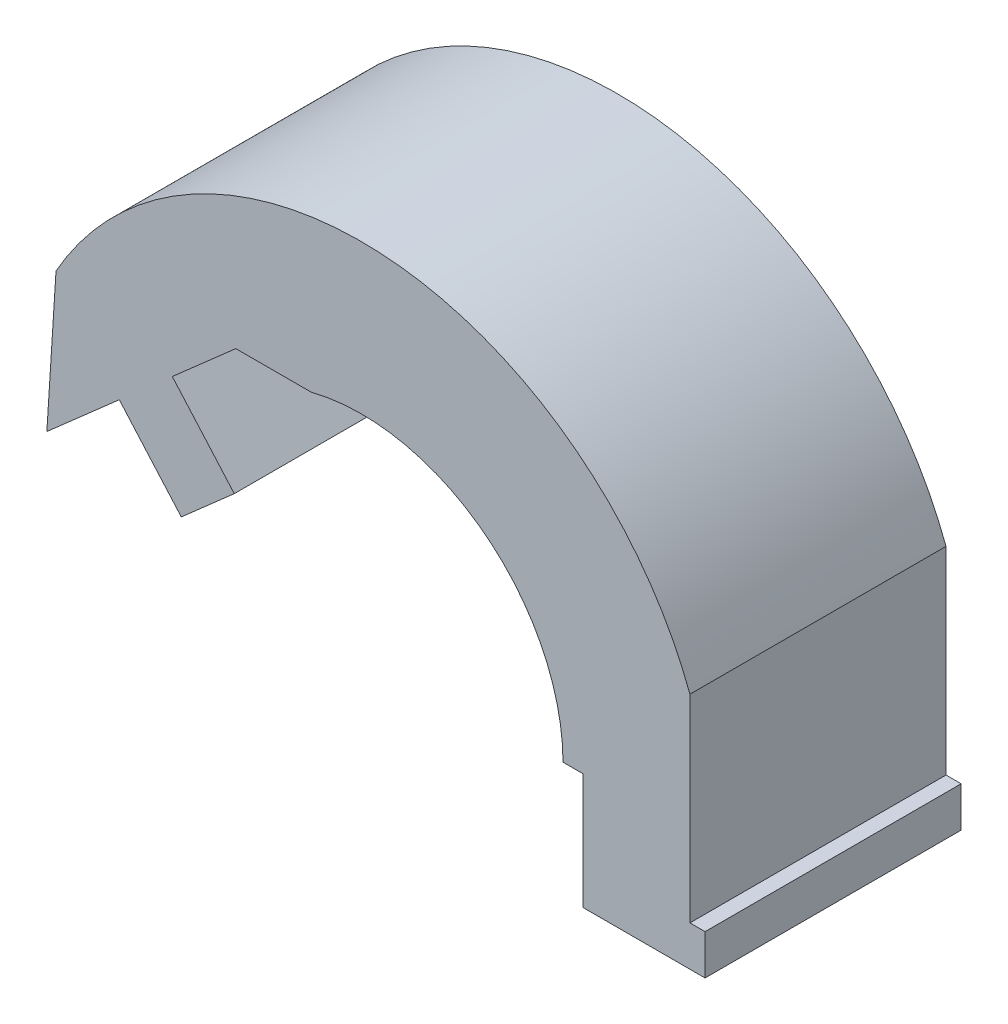
from build123d import *

# Parameters (mm, degrees)
BOSS_EXTRUDE1_DEPTH = 12.7


with BuildPart() as part:
    # Sketch3 → Boss-Extrude1 (new body)
    with BuildSketch(Plane.XY):
        with BuildLine():
            Line((-39.908456621, 10.757671301), (-40.099131524, 10.589864623))
            Line((-40.099131524, 10.589864623), (-43.499378585, 7.5974196))
            Line((-43.499378585, 7.5974196), (-43.044803336, 14.723327074))
            ThreePointArc((-43.044803336, 14.723327074), (-26.54219977, 23.502903952), (-11.60681582, 12.262298946))
            Line((-11.60681582, 12.262298946), (-11.60681582, 5.15464013))
            Line((-11.60681582, 5.15464013), (-11.60681582, 2.440752288))
            Line((-11.60681582, 2.440752288), (-10.85681582, 2.440752288))
            Line((-10.85681582, 2.440752288), (-10.85681582, 0.448752288))
            Line((-10.85681582, 0.448752288), (-16.916890922, 0.448752288))
            Line((-16.916890922, 0.448752288), (-16.916890922, 6.194752288))
            Line((-16.916890922, 6.194752288), (-17.900227072, 6.194752288))
            ThreePointArc((-17.900227072, 6.194752288), (-21.783197569, 14.066907933), (-30.379177034, 15.843824196))
            Line((-30.379177034, 15.843824196), (-34.129177034, 15.843824196))
            Line((-34.129177034, 15.843824196), (-37.088703748, 13.23924258))
            Line((-37.088703748, 13.23924258), (-37.279378651, 13.071435901))
            Line((-37.279378651, 13.071435901), (-34.203525113, 9.576413645))
            Line((-34.203525113, 9.576413645), (-36.832603083, 7.262649045))
            Line((-36.832603083, 7.262649045), (-39.908456621, 10.757671301))
        make_face()
    extrude(amount=-BOSS_EXTRUDE1_DEPTH)


solid = part.part
